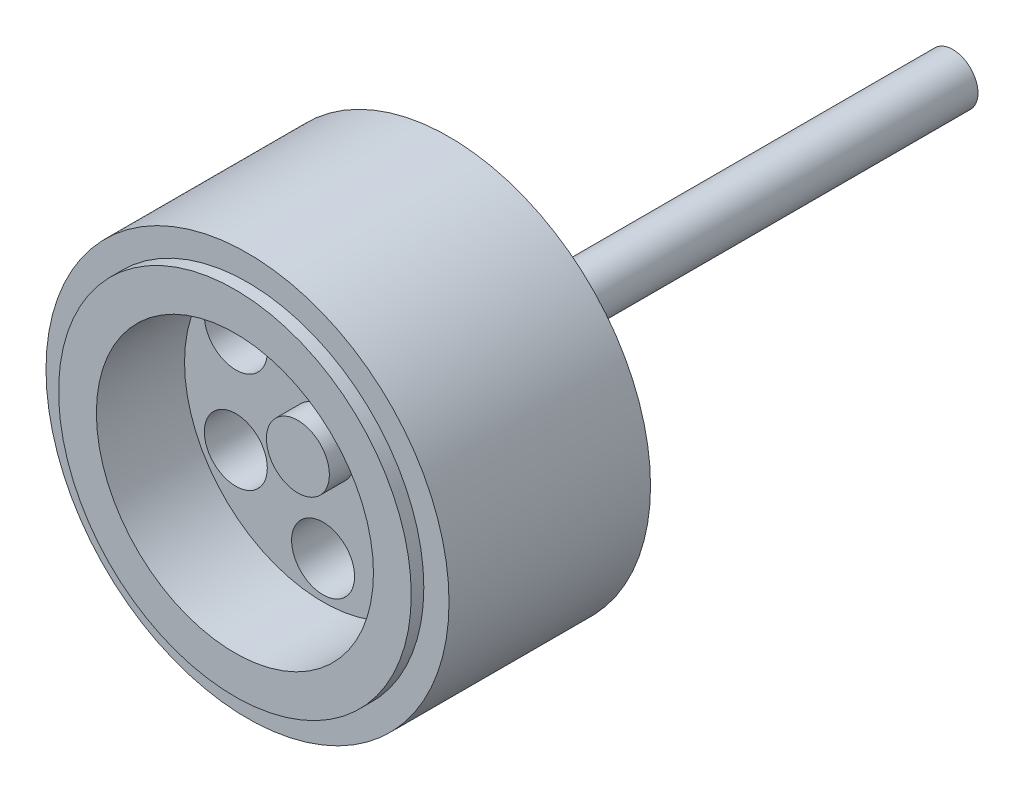
from build123d import *

# Parameters (mm, degrees)
SKETCH3_W          = 31.998
SKETCH3_H          = 5.999
SKETCH2_R          = 5
CUT_EXTRUDE1_DEPTH = 8


with BuildPart() as part:
    # Sketch1 → Revolve1 (revolve)
    with BuildSketch(Plane(origin=(0, 0, 0), x_dir=(0, 0, -1), z_dir=(1, 0, 0)), mode=Mode.PRIVATE) as revolve1_sk:
        Polygon((0, 4), (0, 22), (-14, 22), (-14, 28), (-12, 28), (-12, 26), (20, 26), (20, 28), (22, 28), (22, 22), (20, 22), (8, 22), (8, 10), (20, 10), (22, 10), (22, 4), (20, 4), align=None)
    revolve(revolve1_sk.sketch.rotate(Axis((0, 0, 0), (0, 0, -1)), 90), axis=Axis((0, 0, 0), (0, 0, -1)))

    # Sketch2 → Cut-Extrude1 (cut)
    with BuildSketch(Plane.XY):
        with Locations((0, 16)):
            Circle(SKETCH2_R)
        with Locations((13.856406461, 8)):
            Circle(SKETCH2_R)
        with Locations((13.856406461, -8)):
            Circle(SKETCH2_R)
        with Locations((0, -16)):
            Circle(SKETCH2_R)
        with Locations((-13.856406461, -8)):
            Circle(SKETCH2_R)
        with Locations((-13.856406461, 8)):
            Circle(SKETCH2_R)
    extrude(amount=-CUT_EXTRUDE1_DEPTH, mode=Mode.SUBTRACT)

    # Sketch4 → Revolve3 (revolve)
    with BuildSketch(Plane(origin=(0, 0, 0), x_dir=(0, 0, -1), z_dir=(1, 0, 0)), mode=Mode.PRIVATE) as revolve3_sk:
        Polygon((-0.001, 4), (-0.001, 5), (-4.001, 5), (-4.001, 0), (99.999, 0), (99.999, 4), align=None)
    revolve(revolve3_sk.sketch.rotate(Axis((0, 0, 4.001), (0, 0, -1)), 90), axis=Axis((0, 0, 4.001), (0, 0, -1)))


with BuildPart() as body_2:
    # Sketch3 → Revolve2 (revolve)
    with BuildSketch(Plane(origin=(0, 0, 0), x_dir=(0, 0, -1), z_dir=(1, 0, 0)), mode=Mode.PRIVATE) as revolve2_sk:
        with Locations((4, 29.0005)):
            Rectangle(SKETCH3_W, SKETCH3_H)
    revolve(revolve2_sk.sketch.rotate(Axis((0, 0, 0), (0, 0, -1)), 90), axis=Axis((0, 0, 0), (0, 0, -1)))


solid = Compound([part.part, body_2.part])
